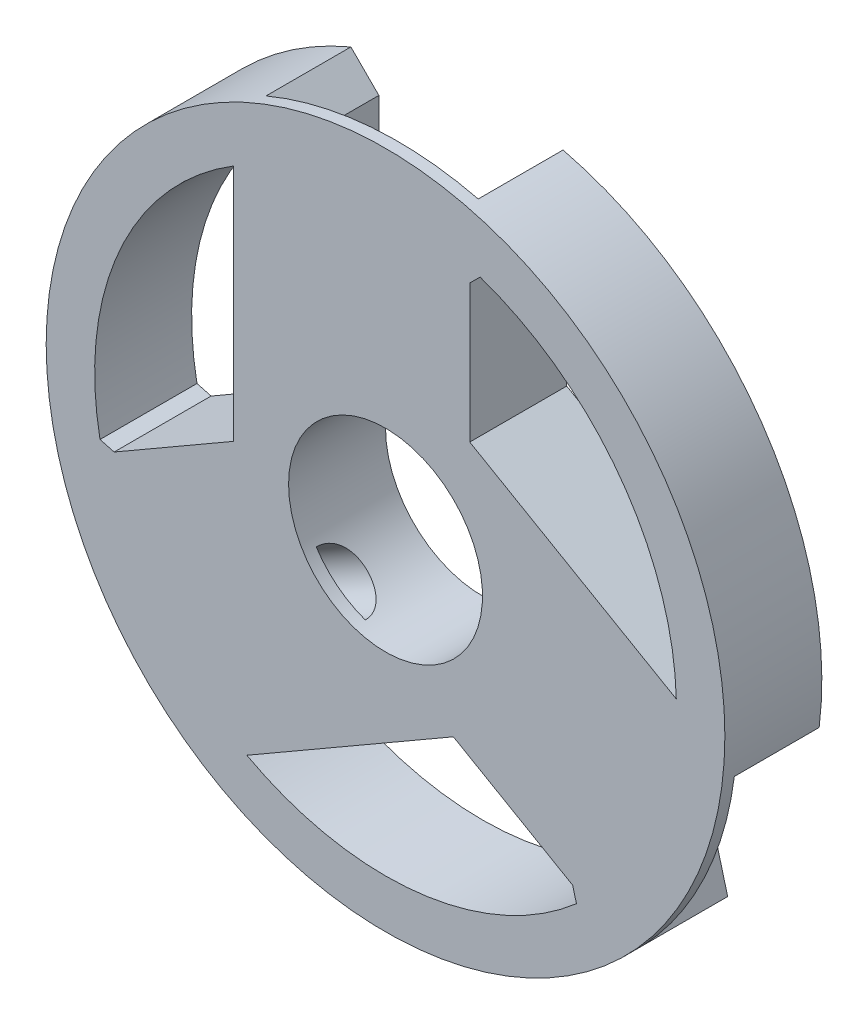
from build123d import *

# Parameters (mm, degrees)
SKETCH1_R               = 250
BOSS_EXTRUDE1_DEPTH     = 5
SKETCH2_R               = 250
SKETCH2_W               = 57.5
SKETCH2_H               = 57.5
BOSS_EXTRUDE2_DEPTH     = 35
SKETCH3_R               = 250
SKETCH3_R_2             = 140
CUT_EXTRUDE1_DEPTH      = 356.808937493
CUT_EXTRUDE2_DEPTH      = 35
SKETCH5_R               = 40
CUT_EXTRUDE3_DEPTH      = 202.990098767
CUT_EXTRUDE4_REACH      = 261.517
CUT_EXTRUDE4_END_RADIUS = 40
CUT_EXTRUDE5_REACH      = 249.386
CUT_EXTRUDE5_END_RADIUS = 40
CUT_EXTRUDE6_REACH      = 261.517
CUT_EXTRUDE6_END_RADIUS = 40
CUT_EXTRUDE7_DEPTH      = 202.990098787


with BuildPart() as part:
    # Sketch1 → Boss-Extrude1 (new body)
    with BuildSketch(Plane.XY):
        Circle(SKETCH1_R)
    extrude(amount=-BOSS_EXTRUDE1_DEPTH)

    # Sketch2 → Boss-Extrude2 (add)
    with BuildSketch(Plane(origin=(0, 0, -5), x_dir=(-1, 0, 0), z_dir=(0, 0, -1))):
        with Locations(Location((0, 0, 0), (0, 0, 180))):
            Circle(SKETCH2_R)
        Polygon((-73.336524227, 7.022586012), (-123.132984945, -21.727413988), (-94.382984945, -71.523874706), (-44.586524227, -42.773874706), align=None, mode=Mode.SUBTRACT)
        with Locations((14, 88.75)):
            Rectangle(SKETCH2_W, SKETCH2_H, mode=Mode.SUBTRACT)
        Polygon((80.382984945, -95.772586012), (30.586524227, -67.022586012), (59.336524227, -17.226125294), (109.132984945, -45.976125294), align=None, mode=Mode.SUBTRACT)
    extrude(amount=BOSS_EXTRUDE2_DEPTH)

    # Sketch3 → Cut-Extrude1 (cut, through all)
    with BuildSketch(Plane(origin=(0, 0, -40), x_dir=(-1, 0, 0), z_dir=(0, 0, -1))):
        Circle(SKETCH3_R)
        Circle(SKETCH3_R_2, mode=Mode.SUBTRACT)
    extrude(amount=-CUT_EXTRUDE1_DEPTH, mode=Mode.SUBTRACT)

    # Sketch4 → Cut-Extrude2 (cut)
    with BuildSketch(Plane(origin=(0, 0, -40), x_dir=(-1, 0, 0), z_dir=(0, 0, -1))):
        with BuildLine():
            Line((42.75, 117.5), (54.293475361, 129.043475361))
            ThreePointArc((54.293475361, 129.043475361), (11.083221394, 139.560604053), (-33.245383921, 135.995383921))
            Line((-33.245383921, 135.995383921), (-14.75, 117.5))
            Line((-14.75, 117.5), (42.75, 117.5))
        make_face()
        with BuildLine():
            Line((-123.132984945, -21.727413988), (-138.901665536, -17.502208758))
            ThreePointArc((-138.901665536, -17.502208758), (-126.404639174, -60.181950743), (-101.152765313, -96.789038995))
            Line((-101.152765313, -96.789038995), (-94.382984945, -71.523874706))
            Line((-94.382984945, -71.523874706), (-123.132984945, -21.727413988))
        make_face()
        with BuildLine():
            Line((80.382984945, -95.772586012), (84.608190175, -111.541266603))
            ThreePointArc((84.608190175, -111.541266603), (115.32141778, -79.378653309), (134.398149234, -39.206344926))
            Line((134.398149234, -39.206344926), (109.132984945, -45.976125294))
            Line((109.132984945, -45.976125294), (80.382984945, -95.772586012))
        make_face()
    extrude(amount=-CUT_EXTRUDE2_DEPTH, mode=Mode.SUBTRACT)

    # Sketch5 → Cut-Extrude3 (cut, through all)
    with BuildSketch(Plane(origin=(0, 0, -40), x_dir=(-1, 0, 0), z_dir=(0, 0, -1))):
        Circle(SKETCH5_R)
    extrude(amount=-CUT_EXTRUDE3_DEPTH, mode=Mode.SUBTRACT)

    # Cut-Extrude4: up to this cylinder (the profile starts outside it)
    cut_extrude4_end = Plane(origin=(0, 0, -10.092958), z_dir=(0, 0, -1)) * Cylinder(CUT_EXTRUDE4_END_RADIUS, 604.034, mode=Mode.PRIVATE)
    # Sketch7 → Cut-Extrude4 (cut, up to the surface)
    with BuildSketch(Plane(origin=(-51.961524227, -30, 0), x_dir=(0, 0, 1), z_dir=(-0.866025403784445, -0.49999999999998906, 0)), mode=Mode.PRIVATE) as cut_extrude4_sk1:
        with BuildLine():
            Line((-5, -26), (-5, -2))
            ThreePointArc((-5, -2), (-17, -14), (-5, -26))
        make_face()
    cut_extrude4_tool1 = extrude(cut_extrude4_sk1.sketch, amount=-CUT_EXTRUDE4_REACH, mode=Mode.PRIVATE) - cut_extrude4_end
    add(cut_extrude4_tool1.solids().sort_by_distance((-44.961524, -42.124356, -10.092958))[0], mode=Mode.SUBTRACT)

    # Cut-Extrude5: up to this cylinder (the profile starts outside it)
    cut_extrude5_end = Plane(origin=(0, 0, -10.092958), z_dir=(0, 0, -1)) * Cylinder(CUT_EXTRUDE5_END_RADIUS, 579.772, mode=Mode.PRIVATE)
    # Sketch8 → Cut-Extrude5 (cut, up to the surface)
    with BuildSketch(Plane(origin=(0, 60, 0), x_dir=(1, 0, 0), z_dir=(0, 1, 0)), mode=Mode.PRIVATE) as cut_extrude5_sk1:
        with BuildLine():
            Line((-26, 5), (-2, 5))
            ThreePointArc((-2, 5), (-14, 17), (-26, 5))
        make_face()
    cut_extrude5_tool1 = extrude(cut_extrude5_sk1.sketch, amount=-CUT_EXTRUDE5_REACH, mode=Mode.PRIVATE) - cut_extrude5_end
    add(cut_extrude5_tool1.solids().sort_by_distance((-14, 60, -10.092958))[0], mode=Mode.SUBTRACT)

    # Cut-Extrude6: up to this cylinder (the profile starts outside it)
    cut_extrude6_end = Plane(origin=(0, 0, -10.092958), z_dir=(0, 0, -1)) * Cylinder(CUT_EXTRUDE6_END_RADIUS, 604.034, mode=Mode.PRIVATE)
    # Sketch9 → Cut-Extrude6 (cut, up to the surface)
    with BuildSketch(Plane(origin=(51.961524227, -30, 0), x_dir=(0, 0, -1), z_dir=(0.8660254037844376, -0.5000000000000019, 0)), mode=Mode.PRIVATE) as cut_extrude6_sk1:
        with BuildLine():
            Line((5, 26), (5, 2))
            ThreePointArc((5, 2), (17, 14), (5, 26))
        make_face()
    cut_extrude6_tool1 = extrude(cut_extrude6_sk1.sketch, amount=-CUT_EXTRUDE6_REACH, mode=Mode.PRIVATE) - cut_extrude6_end
    add(cut_extrude6_tool1.solids().sort_by_distance((58.961524, -17.875644, -10.092958))[0], mode=Mode.SUBTRACT)

    # Sketch10 → Cut-Extrude7 (cut, through all)
    with BuildSketch(Plane(origin=(0, 0, -40), x_dir=(-1, 0, 0), z_dir=(0, 0, -1))):
        with BuildLine():
            Line((62.75, 40), (62.75, 3.897114317))
            Line((62.75, 3.897114317), (111.958595593, -24.513481595))
            Line((111.958595593, -24.513481595), (117.784487806, -22.952438481))
            ThreePointArc((117.784487806, -22.952438481), (109.860573104, 48.276852396), (62.75, 102.286057212))
            Line((62.75, 102.286057212), (62.75, 40))
        make_face()
        with BuildLine():
            Line((3.266016151, -74.343094087), (-28, -56.291651246))
            Line((-28, -56.291651246), (-77.208595593, -84.702247158))
            Line((-77.208595593, -84.702247158), (-78.769638706, -90.528139372))
            ThreePointArc((-78.769638706, -90.528139372), (-13.121305962, -119.28047338), (57.207323999, -105.486122694))
            Line((57.207323999, -105.486122694), (3.266016151, -74.343094087))
        make_face()
        with BuildLine():
            Line((-66.016016151, 34.343094087), (-34.75, 52.394536929))
            Line((-34.75, 52.394536929), (-34.75, 109.215728753))
            Line((-34.75, 109.215728753), (-39.0148491, 113.480577852))
            ThreePointArc((-39.0148491, 113.480577852), (-96.739267142, 71.003620984), (-119.957323999, 3.200065481))
            Line((-119.957323999, 3.200065481), (-66.016016151, 34.343094087))
        make_face()
    extrude(amount=-CUT_EXTRUDE7_DEPTH, mode=Mode.SUBTRACT)


solid = part.part
